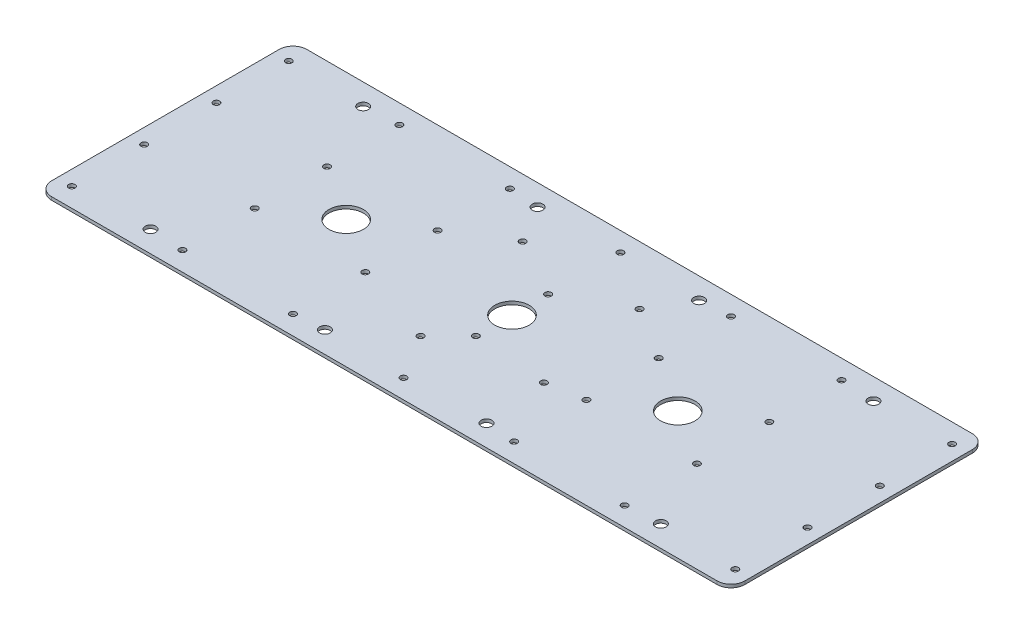
from build123d import *

# Parameters (mm, degrees)
ESQUISSE1_W             = 163
ESQUISSE1_H             = 120
BOSS_EXTRU_1_DEPTH      = 1.5
CONG_2_R                = 6.5
ESQUISSE4_R             = 2.5
ENL_V_MAT_EXTRU_3_DEPTH = 174.698733444
ESQUISSE7_R             = 1.5
ENL_V_MAT_EXTRU_5_DEPTH = 174.698733444
ESQUISSE8_R             = 8.1
ENL_V_MAT_EXTRU_6_DEPTH = 174.698733444
ESQUISSE9_R             = 1.5
ENL_V_MAT_EXTRU_7_DEPTH = 174.698733444


with BuildPart() as part:
    # Esquisse1 → Boss.-Extru.1 (new body)
    with BuildSketch(Plane(origin=(0, 0, 0), x_dir=(1, 0, 0), z_dir=(0, 1, 0))):
        with Locations((81.5, 0)):
            Rectangle(ESQUISSE1_W, ESQUISSE1_H)
    extrude(amount=BOSS_EXTRU_1_DEPTH)

    # Congé2
    cong_2_edges = [part.edges().sort_by_distance(p)[0] for p in [
        (163, 0.75, -60),
        (163, 0.75, 60),
    ]]
    fillet(cong_2_edges, radius=CONG_2_R)

    # Esquisse4 → Enlèv. mat.-Extru.3 (cut, through all)
    with BuildSketch(Plane(origin=(0, 1.5, 0), x_dir=(1, 0, 0), z_dir=(0, 1, 0))):
        with Locations(Location((120, -50, 0), (0, 0, 270))):
            Circle(ESQUISSE4_R)
        with Locations(Location((38, -50, 0), (0, 0, 270))):
            Circle(ESQUISSE4_R)
        with Locations(Location((38, 50, 0), (0, 0, 90))):
            Circle(ESQUISSE4_R)
        with Locations(Location((120, 50, 0), (0, 0, 90))):
            Circle(ESQUISSE4_R)
    extrude(amount=-ENL_V_MAT_EXTRU_3_DEPTH, mode=Mode.SUBTRACT)

    # Symétrie1: part across plane


with BuildPart() as part_1:
    add(part.part)
    add(part.part.mirror(Plane(origin=(0, 1.5, -60), x_dir=(0, 0, 1), z_dir=(1, 0, 0))))

    # Esquisse7 → Enlèv. mat.-Extru.5 (cut, through all)
    with BuildSketch(Plane(origin=(0, 1.5, 0), x_dir=(1, 0, 0), z_dir=(0, 1, 0))):
        with Locations(Location((-156, -51, 0), (0, 0, 270))):
            Circle(ESQUISSE7_R)
        with Locations(Location((-104, -51, 0), (0, 0, 270))):
            Circle(ESQUISSE7_R)
        with Locations(Location((-52, -51, 0), (0, 0, 270))):
            Circle(ESQUISSE7_R)
        with Locations(Location((0, -51, 0), (0, 0, 270))):
            Circle(ESQUISSE7_R)
        with Locations(Location((52, -51, 0), (0, 0, 270))):
            Circle(ESQUISSE7_R)
        with Locations(Location((-104, -17, 0), (0, 0, 270))):
            Circle(ESQUISSE7_R)
        with Locations(Location((-52, -17, 0), (0, 0, 270))):
            Circle(ESQUISSE7_R)
        with Locations(Location((0, -17, 0), (0, 0, 270))):
            Circle(ESQUISSE7_R)
        with Locations(Location((52, -17, 0), (0, 0, 270))):
            Circle(ESQUISSE7_R)
        with Locations(Location((-104, 17, 0), (0, 0, 270))):
            Circle(ESQUISSE7_R)
        with Locations(Location((-52, 17, 0), (0, 0, 270))):
            Circle(ESQUISSE7_R)
        with Locations(Location((0, 17, 0), (0, 0, 270))):
            Circle(ESQUISSE7_R)
        with Locations(Location((52, 17, 0), (0, 0, 270))):
            Circle(ESQUISSE7_R)
        with Locations(Location((-156, -17, 0), (0, 0, 270))):
            Circle(ESQUISSE7_R)
        with Locations(Location((-156, 17, 0), (0, 0, 270))):
            Circle(ESQUISSE7_R)
        with Locations(Location((-156, 51, 0), (0, 0, 270))):
            Circle(ESQUISSE7_R)
        with Locations(Location((-104, 51, 0), (0, 0, 270))):
            Circle(ESQUISSE7_R)
        with Locations(Location((-52, 51, 0), (0, 0, 270))):
            Circle(ESQUISSE7_R)
        with Locations(Location((0, 51, 0), (0, 0, 270))):
            Circle(ESQUISSE7_R)
        with Locations(Location((52, 51, 0), (0, 0, 270))):
            Circle(ESQUISSE7_R)
        with Locations(Location((104, -51, 0), (0, 0, 270))):
            Circle(ESQUISSE7_R)
        with Locations(Location((104, -17, 0), (0, 0, 270))):
            Circle(ESQUISSE7_R)
        with Locations(Location((104, 17, 0), (0, 0, 270))):
            Circle(ESQUISSE7_R)
        with Locations(Location((104, 51, 0), (0, 0, 270))):
            Circle(ESQUISSE7_R)
        with Locations(Location((156, -51, 0), (0, 0, 270))):
            Circle(ESQUISSE7_R)
        with Locations(Location((156, -17, 0), (0, 0, 270))):
            Circle(ESQUISSE7_R)
        with Locations(Location((156, 17, 0), (0, 0, 270))):
            Circle(ESQUISSE7_R)
        with Locations(Location((156, 51, 0), (0, 0, 270))):
            Circle(ESQUISSE7_R)
    extrude(amount=-ENL_V_MAT_EXTRU_5_DEPTH, mode=Mode.SUBTRACT)

    # Esquisse8 → Enlèv. mat.-Extru.6 (cut, through all)
    with BuildSketch(Plane(origin=(0, 1.5, 0), x_dir=(1, 0, 0), z_dir=(0, 1, 0))):
        with Locations(Location((0, 0, 0), (0, 0, 270))):
            Circle(ESQUISSE8_R)
        with Locations(Location((-78, 0, 0), (0, 0, 270))):
            Circle(ESQUISSE8_R)
        with Locations(Location((78, 0, 0), (0, 0, 270))):
            Circle(ESQUISSE8_R)
    extrude(amount=-ENL_V_MAT_EXTRU_6_DEPTH, mode=Mode.SUBTRACT)

    # Esquisse9 → Enlèv. mat.-Extru.7 (cut, through all)
    with BuildSketch(Plane(origin=(0, 1.5, 0), x_dir=(1, 0, 0), z_dir=(0, 1, 0))):
        with Locations(Location((27.5, 32.5, 0), (0, 0, 270))):
            Circle(ESQUISSE9_R)
        with Locations(Location((-13, -30, 0), (0, 0, 270))):
            Circle(ESQUISSE9_R)
        with Locations(Location((35, -20, 0), (0, 0, 270))):
            Circle(ESQUISSE9_R)
        with Locations(Location((-27.5, 32.5, 0), (0, 0, 90))):
            Circle(ESQUISSE9_R)
    extrude(amount=-ENL_V_MAT_EXTRU_7_DEPTH, mode=Mode.SUBTRACT)


solid = part_1.part
